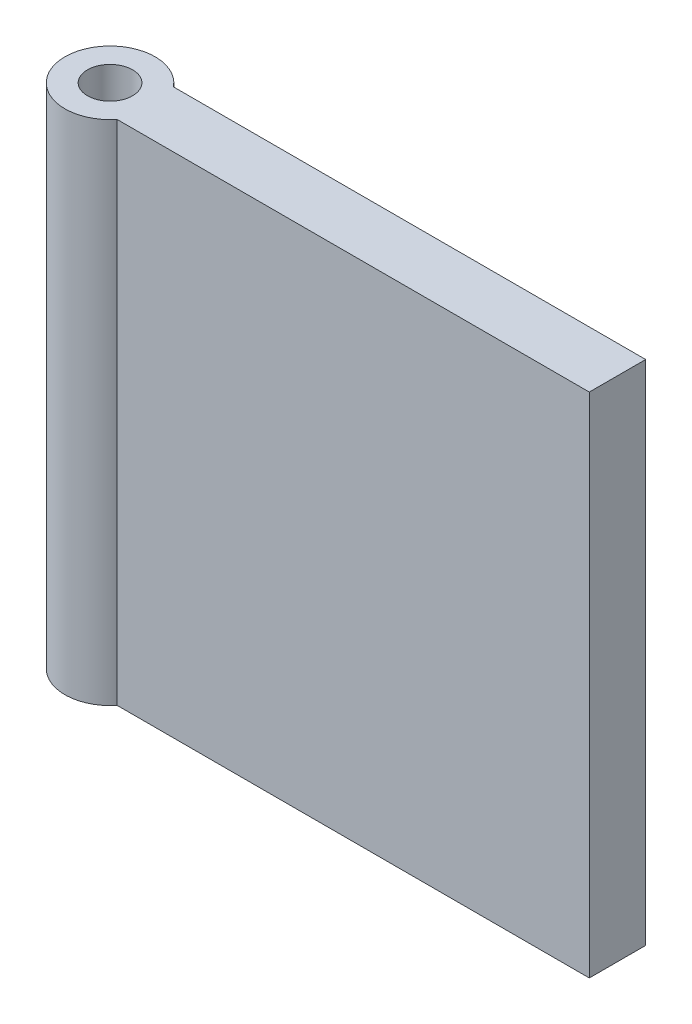
from build123d import *

# Parameters (mm, degrees)
SKETCH2_R           = 4
SKETCH2_W           = 45
SKETCH2_H           = 5
BOSS_EXTRUDE1_DEPTH = 45
SKETCH3_R           = 2
CUT_EXTRUDE1_DEPTH  = 64.765194268


with BuildPart() as part:
    # Sketch2 → Boss-Extrude1 (new body)
    with BuildSketch(Plane(origin=(0, 0, 0), x_dir=(1, 0, 0), z_dir=(0, 1, 0))):
        Circle(SKETCH2_R)
        with Locations((22.5, 0)):
            Rectangle(SKETCH2_W, SKETCH2_H)
    extrude(amount=BOSS_EXTRUDE1_DEPTH)

    # Sketch3 → Cut-Extrude1 (cut, through all)
    with BuildSketch(Plane(origin=(0, 45, 0), x_dir=(1, 0, 0), z_dir=(0, 1, 0))):
        with Locations(Location((0, 0, 0), (0, 0, 270))):
            Circle(SKETCH3_R)
    extrude(amount=-CUT_EXTRUDE1_DEPTH, mode=Mode.SUBTRACT)


solid = part.part
